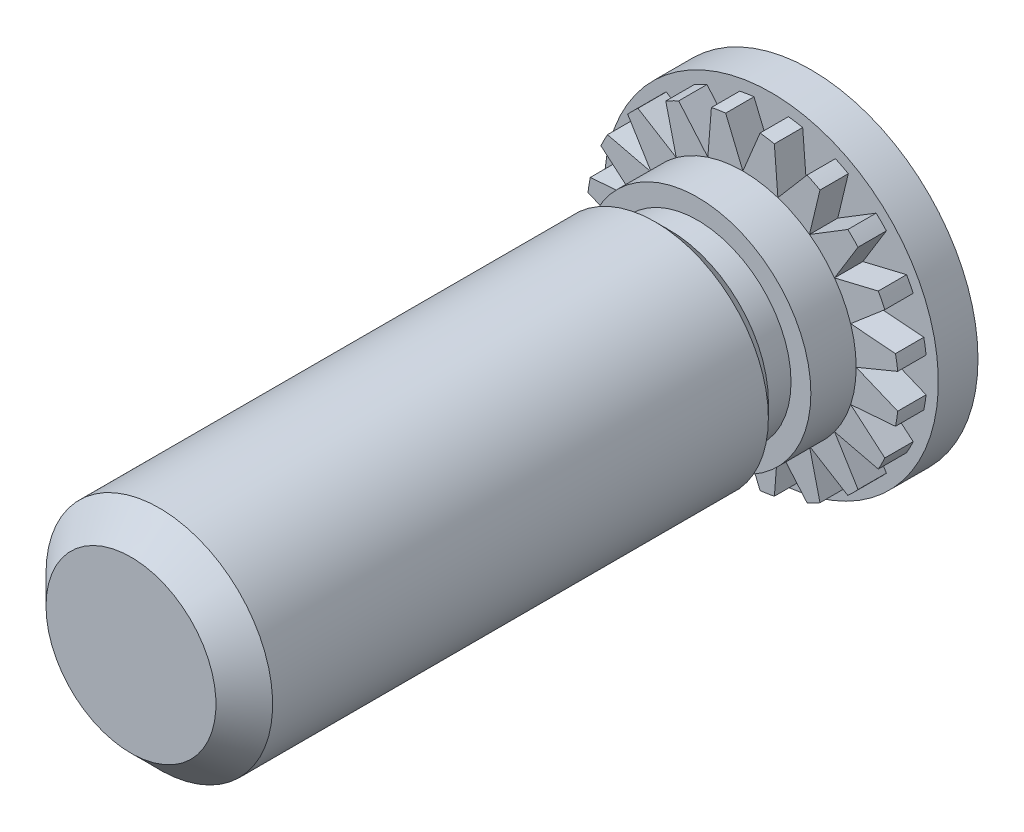
from build123d import *

# Parameters (mm, degrees)
SKETCH_1_R               = 2.95
EXTRUDE_1_DEPTH          = 1.2
SKETCH_2_R               = 2
EXTRUDE_2_DEPTH          = 1.9
CUT_EXTRUDE_1_DEPTH      = 0.5
PATTERN_CIRCULAR_1_COUNT = 20
SKETCH_4_W               = 0.35
SKETCH_4_H               = 0.5
SKETCH_6_W               = 8.9
SKETCH_6_H               = 2
CHAMFER_2_SIZE           = 0.5
CUT_EXTRUDE_START        = -0.5
SKETCH_7_R               = 2.95
SKETCH_7_R_2             = 2.75
CUT_EXTRUDE_2_DEPTH      = 0.5
CHAMFER_3_SIZE           = 0.25


with BuildPart() as part:
    # Эскиз1 → Вытянуть1 (new body)
    with BuildSketch(Plane.XY):
        Circle(SKETCH_1_R)
    extrude(amount=EXTRUDE_1_DEPTH)

    # Эскиз2 → Вытянуть2 (add)
    with BuildSketch(Plane.XY.offset(1.2)):
        with Locations(Location((0, 0, 0), (0, 0, 180))):
            Circle(SKETCH_2_R)
    extrude(amount=EXTRUDE_2_DEPTH)

    # Эскиз3 → Вырез-Вытянуть1 (cut)
    with BuildSketch(Plane.XY.offset(1.2)):
        Polygon((-0.393502884, 2.95), (0.393502884, 2.95), (0, 2), align=None)
    cut_extrude_1 = extrude(amount=-CUT_EXTRUDE_1_DEPTH, mode=Mode.SUBTRACT)

    # Круговой массив1: Вырез-Вытянуть1 ×20 about axis
    pattern_circular_1_axis = Axis((0, 0, 0), (0, 0, 1))
    for i in range(1, PATTERN_CIRCULAR_1_COUNT):
        add(cut_extrude_1.rotate(pattern_circular_1_axis, i * 360 / PATTERN_CIRCULAR_1_COUNT), mode=Mode.SUBTRACT)

    # Эскиз4 → Вырез-Повернуть1 (revolve, cut)
    with BuildSketch(Plane(origin=(0, 0, 0), x_dir=(1, 0, 0), z_dir=(0, 1, 0)), mode=Mode.PRIVATE) as cut_revolve_1_sk:
        with Locations((1.825, -2.25)):
            Rectangle(SKETCH_4_W, SKETCH_4_H)
    revolve(cut_revolve_1_sk.sketch.rotate(Axis((0, 0, 14.805168786), (0, 0, -1)), 172.537215717), axis=Axis((0, 0, 14.805168786), (0, 0, -1)), mode=Mode.SUBTRACT)

    # Эскиз6 → Повернуть1 (revolve)
    with BuildSketch(Plane(origin=(0, 0, 0), x_dir=(0, 0, -1), z_dir=(1, 0, 0)), mode=Mode.PRIVATE) as revolve_1_sk:
        with Locations((-7.55, -1)):
            Rectangle(SKETCH_6_W, SKETCH_6_H)
    revolve(revolve_1_sk.sketch.rotate(Axis((0, 0, 3.1), (0, 0, 1)), 277.462784283), axis=Axis((0, 0, 3.1), (0, 0, 1)))

    # Фаска2
    chamfer_2_edges = [part.edges().sort_by_distance(p)[0] for p in [
        (1.983058868, 0.25976437, 12),
    ]]
    chamfer(chamfer_2_edges, length=CHAMFER_2_SIZE)

    # Эскиз7 → Вырез-Вытянуть2 (cut)
    with BuildSketch(Plane.XY.offset(1.2).offset(CUT_EXTRUDE_START)):
        with Locations(Location((0, 0, 0), (0, 0, 180))):
            Circle(SKETCH_7_R)
        Circle(SKETCH_7_R_2, mode=Mode.SUBTRACT)
    extrude(amount=CUT_EXTRUDE_2_DEPTH, mode=Mode.SUBTRACT)

    # Фаска3
    chamfer_3_edges = [part.edges().sort_by_distance(p)[0] for p in [
        (2, 0, 2.5),
    ]]
    chamfer(chamfer_3_edges, length=CHAMFER_3_SIZE)


solid = part.part
